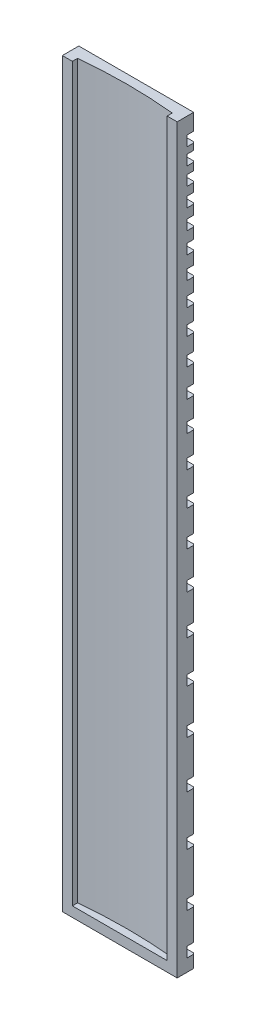
from build123d import *

# Parameters (mm, degrees)
SKETCH2_W               = 73.126
SKETCH2_H               = 465.703533893
BOSS_EXTRUDE1_DEPTH     = 12.8
CUT_EXTRUDE3_DEPTH      = 468.311966945
CUT_EXTRUDE3_DEPTH_BACK = 468.311966945
SKETCH4_W               = 73.126
SKETCH4_H               = 6.4
BOSS_EXTRUDE3_DEPTH     = 12.8
CHAMFER5_SIZE           = 0.7
SKETCH1_W               = 80.142296905
SKETCH1_H               = 6.5
CUT_EXTRUDE4_DEPTH      = 5
SKETCH7_W               = 73.126
SKETCH7_H               = 472.103533893
CUT_EXTRUDE7_DEPTH      = 1.6


with BuildPart() as part:
    # Sketch2 → Boss-Extrude1 (new body)
    with BuildSketch(Plane.XY):
        with Locations((0, 232.851766947)):
            Rectangle(SKETCH2_W, SKETCH2_H)
    extrude(amount=BOSS_EXTRUDE1_DEPTH)

    # Sketch3 → Cut-Extrude3 (cut, two sides: drawn at the far end of the back side and taken through both)
    with BuildSketch(Plane(origin=(0, 0, 0), x_dir=(1, 0, 0), z_dir=(0, 1, 0)).offset(-CUT_EXTRUDE3_DEPTH_BACK)):
        with BuildLine():
            Line((30.163, -158.685232104), (30.163, -12.8))
            Line((30.163, -12.8), (30.163, -7.896136802))
            ThreePointArc((30.163, -7.896136802), (0, -6.4), (-30.163, -7.896136802))
            Line((-30.163, -7.896136802), (-30.163, -12.8))
            Line((-30.163, -12.8), (-30.163, -158.685232104))
            Line((-30.163, -158.685232104), (-30.163, -450.455696312))
            Line((-30.163, -450.455696312), (30.163, -450.455696312))
            Line((30.163, -450.455696312), (30.163, -158.685232104))
        make_face()
    extrude(amount=CUT_EXTRUDE3_DEPTH + CUT_EXTRUDE3_DEPTH_BACK, mode=Mode.SUBTRACT)

    # Sketch4 → Boss-Extrude3 (add)
    with BuildSketch(Plane.XY):
        with Locations((0, -3.2)):
            Rectangle(SKETCH4_W, SKETCH4_H)
    extrude(amount=BOSS_EXTRUDE3_DEPTH)

    # Chamfer5
    chamfer5_edges = [part.edges().sort_by_distance(p)[0] for p in [
        (0, -6.4, 0),
        (0, 465.703533893, 0),
        (36.563, 229.651766947, 0),
        (-36.563, 229.651766947, 0),
    ]]
    chamfer(chamfer5_edges, length=CHAMFER5_SIZE)

    # Sketch1 → Cut-Extrude4 (cut)
    with BuildSketch(Plane.XY):
        with Locations((0.607494054, 452.05915)):
            Rectangle(SKETCH1_W, SKETCH1_H)
        with Locations((0.607494054, 441.46337)):
            Rectangle(SKETCH1_W, SKETCH1_H)
        with Locations((0.607494054, 64.52931)):
            Rectangle(SKETCH1_W, SKETCH1_H)
        with Locations((0.607494054, 96.28078)):
            Rectangle(SKETCH1_W, SKETCH1_H)
        with Locations((0.607494054, 363.26539)):
            Rectangle(SKETCH1_W, SKETCH1_H)
        with Locations((0.607494054, 154.5375)):
            Rectangle(SKETCH1_W, SKETCH1_H)
        with Locations((0.607494054, 206.43835)):
            Rectangle(SKETCH1_W, SKETCH1_H)
        with Locations((0.607494054, 252.67674)):
            Rectangle(SKETCH1_W, SKETCH1_H)
        with Locations((0.607494054, 293.87047)):
            Rectangle(SKETCH1_W, SKETCH1_H)
        with Locations((0.607494054, 330.56991)):
            Rectangle(SKETCH1_W, SKETCH1_H)
        with Locations((0.607494054, 378.25008)):
            Rectangle(SKETCH1_W, SKETCH1_H)
        with Locations((0.607494054, 405.7436)):
            Rectangle(SKETCH1_W, SKETCH1_H)
        with Locations((0.607494054, 30.88981)):
            Rectangle(SKETCH1_W, SKETCH1_H)
        with Locations((0.607494054, 430.23753)):
            Rectangle(SKETCH1_W, SKETCH1_H)
        with Locations((0.607494054, 418.34417)):
            Rectangle(SKETCH1_W, SKETCH1_H)
        with Locations((0.607494054, 392.39375)):
            Rectangle(SKETCH1_W, SKETCH1_H)
        with Locations((0.607494054, 126.25017)):
            Rectangle(SKETCH1_W, SKETCH1_H)
        with Locations((0.607494054, 347.38966)):
            Rectangle(SKETCH1_W, SKETCH1_H)
        with Locations((0.607494054, 181.23719)):
            Rectangle(SKETCH1_W, SKETCH1_H)
        with Locations((0.607494054, 312.75)):
            Rectangle(SKETCH1_W, SKETCH1_H)
        with Locations((0.607494054, 230.22507)):
            Rectangle(SKETCH1_W, SKETCH1_H)
        with Locations((0.607494054, 273.8683)):
            Rectangle(SKETCH1_W, SKETCH1_H)
        with Locations((0.607494054, 4.75)):
            Rectangle(SKETCH1_W, SKETCH1_H)
    extrude(amount=CUT_EXTRUDE4_DEPTH, mode=Mode.SUBTRACT)

    # Sketch7 → Cut-Extrude7 (cut)
    with BuildSketch(Plane.XY.offset(12.8)):
        with Locations((0, 229.651766947)):
            Rectangle(SKETCH7_W, SKETCH7_H)
    extrude(amount=-CUT_EXTRUDE7_DEPTH, mode=Mode.SUBTRACT)


solid = part.part
